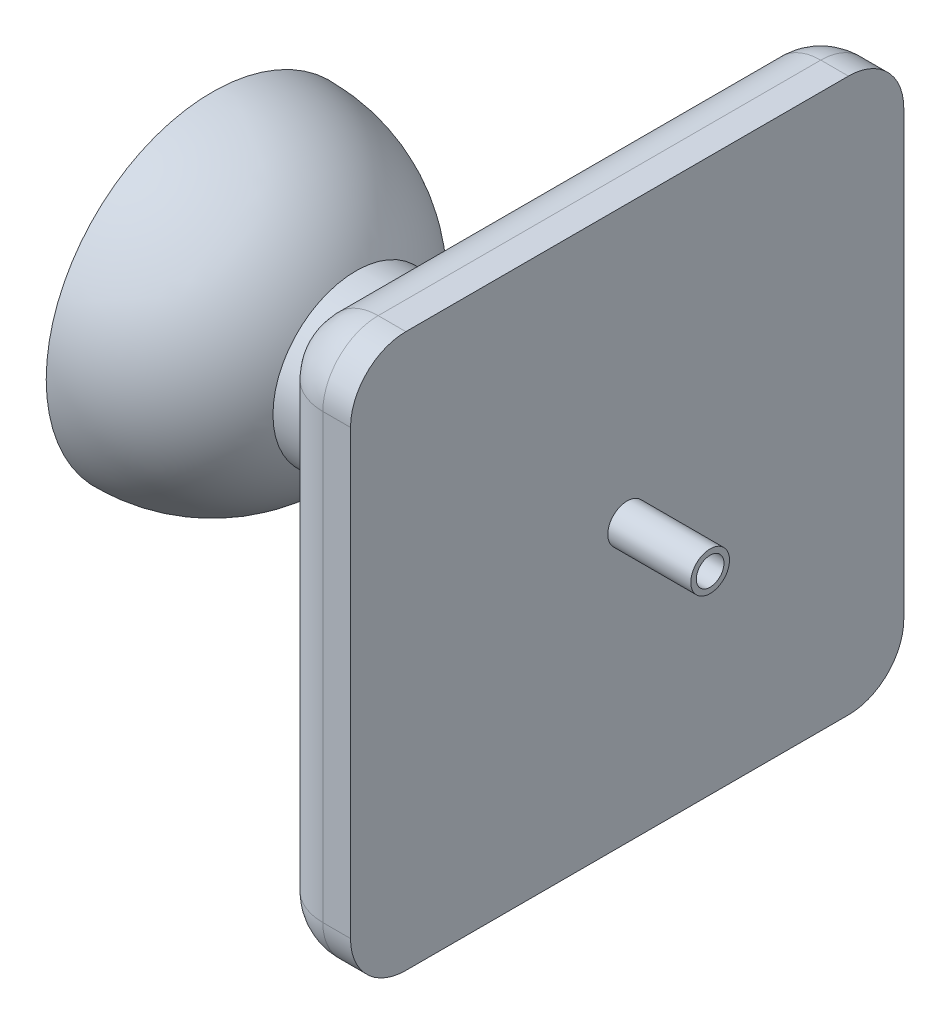
from build123d import *

# Parameters (mm, degrees)
SALIENTE_EXTRUIR1_START             = -40
CROQUIS3_R                          = 15
SALIENTE_EXTRUIR1_DEPTH             = 20
SALIENTE_EXTRUIR1_DIRECTION_2_REACH = 93.962
CROQUIS4_W                          = 100
CROQUIS4_H                          = 100
SALIENTE_EXTRUIR2_DEPTH             = 15
REDONDEO1_R                         = 10
REDONDEO2_R                         = 10
CROQUIS5_R                          = 3.5
CROQUIS5_R_2                        = 2.5
SALIENTE_EXTRUIR3_DEPTH             = 15


with BuildPart() as part:
    # Croquis2 → Revolución-Lámina1 (revolve)
    with BuildSketch(Plane.XY):
        with BuildLine():
            ThreePointArc((25, 0), (17.67766953, 17.67766953), (0, 25))
            Line((0, 25), (0, 30))
            ThreePointArc((0, 30), (21.213203436, 21.213203436), (30, 0))
            Line((30, 0), (25, 0))
        make_face()
    revolve(axis=Axis((0, 0, 0), (1, 0, 0)))

    # Croquis3 → Saliente-Extruir1 (add)
    with BuildSketch(Plane.ZY.offset(SALIENTE_EXTRUIR1_START)):
        Circle(CROQUIS3_R)
    extrude(amount=-SALIENTE_EXTRUIR1_DEPTH)

    # Croquis3 → Saliente-Extruir1 direction 2 (add, up to next)
    with BuildSketch(Plane.ZY.offset(SALIENTE_EXTRUIR1_START), mode=Mode.PRIVATE) as saliente_extruir1_direction_2_sk1:
        Circle(CROQUIS3_R)
    saliente_extruir1_direction_2_tool1 = extrude(saliente_extruir1_direction_2_sk1.sketch, amount=SALIENTE_EXTRUIR1_DIRECTION_2_REACH, mode=Mode.PRIVATE) - part.part
    add(saliente_extruir1_direction_2_tool1.solids().sort_by_distance((40, 0, 0))[0])

    # Croquis4 → Saliente-Extruir2 (add)
    with BuildSketch(Plane(origin=(60, 0, 0), x_dir=(0, 0, -1), z_dir=(1, 0, 0))):
        Rectangle(CROQUIS4_W, CROQUIS4_H)
    extrude(amount=SALIENTE_EXTRUIR2_DEPTH)

    # Redondeo1
    redondeo1_edges = [part.edges().sort_by_distance(p)[0] for p in [
        (67.5, -50, -50),
        (67.5, 50, -50),
        (67.5, 50, 50),
        (67.5, -50, 50),
    ]]
    fillet(redondeo1_edges, radius=REDONDEO1_R)

    # Redondeo2
    redondeo2_edges = [part.edges().sort_by_distance(p)[0] for p in [
        (60, 0, -50),
        (60, -50, 0),
        (60, 0, 50),
        (60, 50, 0),
        (60, 47.071067812, -47.071067812),
        (60, 47.071067812, 47.071067812),
        (60, -47.071067812, 47.071067812),
        (60, -47.071067812, -47.071067812),
    ]]
    fillet(redondeo2_edges, radius=REDONDEO2_R)

    # Croquis5 → Saliente-Extruir3 (add)
    with BuildSketch(Plane(origin=(75, 0, 0), x_dir=(0, 0, -1), z_dir=(1, 0, 0))):
        with Locations(Location((0, 0, 0), (0, 0, 180))):
            Circle(CROQUIS5_R)
        Circle(CROQUIS5_R_2, mode=Mode.SUBTRACT)
    extrude(amount=SALIENTE_EXTRUIR3_DEPTH)


solid = part.part
